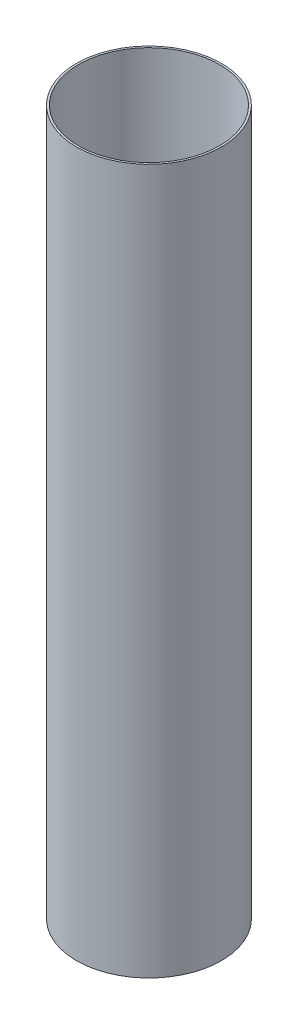
from build123d import *

# Parameters (mm, degrees)
SKETCH1_R           = 78.359
SKETCH1_R_2         = 76.2
BOSS_EXTRUDE1_DEPTH = 762


with BuildPart() as part:
    # Sketch1 → Boss-Extrude1 (new body)
    with BuildSketch(Plane(origin=(0, 0, 0), x_dir=(1, 0, 0), z_dir=(0, 1, 0))):
        with Locations(Location((0, 0, 0), (0, 0, 270))):
            Circle(SKETCH1_R)
        with Locations(Location((0, 0, 0), (0, 0, 270))):
            Circle(SKETCH1_R_2, mode=Mode.SUBTRACT)
    extrude(amount=BOSS_EXTRUDE1_DEPTH)


solid = part.part
